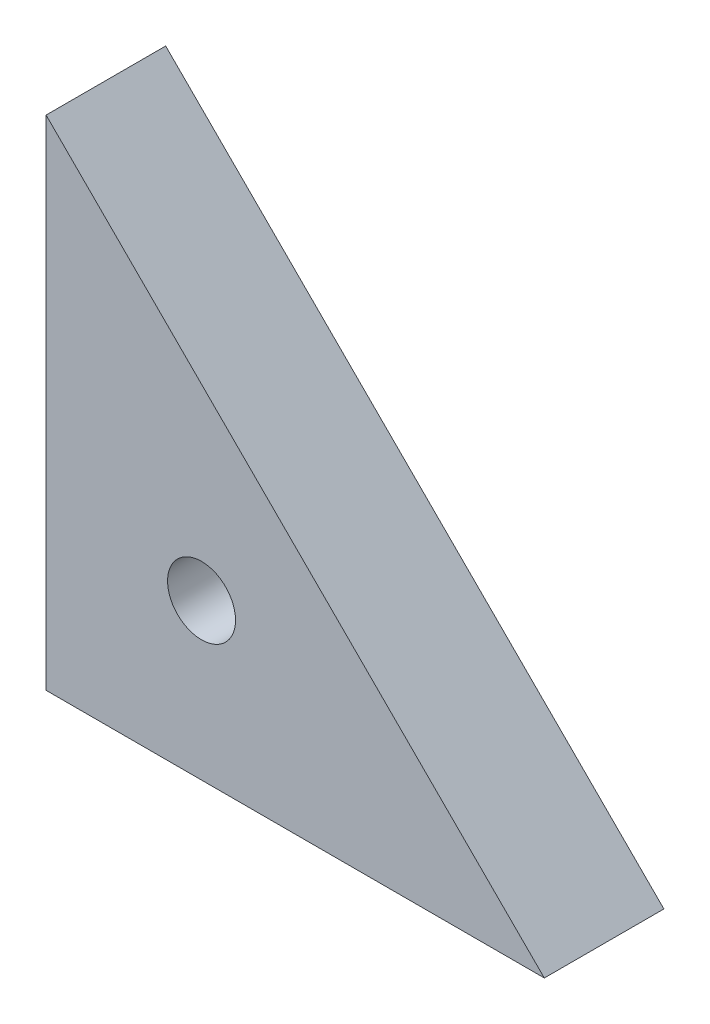
from build123d import *

# Parameters (mm, degrees)
SKETCH1_R           = 1.705
BOSS_EXTRUDE1_DEPTH = 6


with BuildPart() as part:
    # Sketch1 → Boss-Extrude1 (new body)
    with BuildSketch(Plane.XY):
        Polygon((0, 0), (0, 25), (25, 0), align=None)
        with Locations((7.8, 7.8)):
            Circle(SKETCH1_R, mode=Mode.SUBTRACT)
    extrude(amount=BOSS_EXTRUDE1_DEPTH)


solid = part.part
